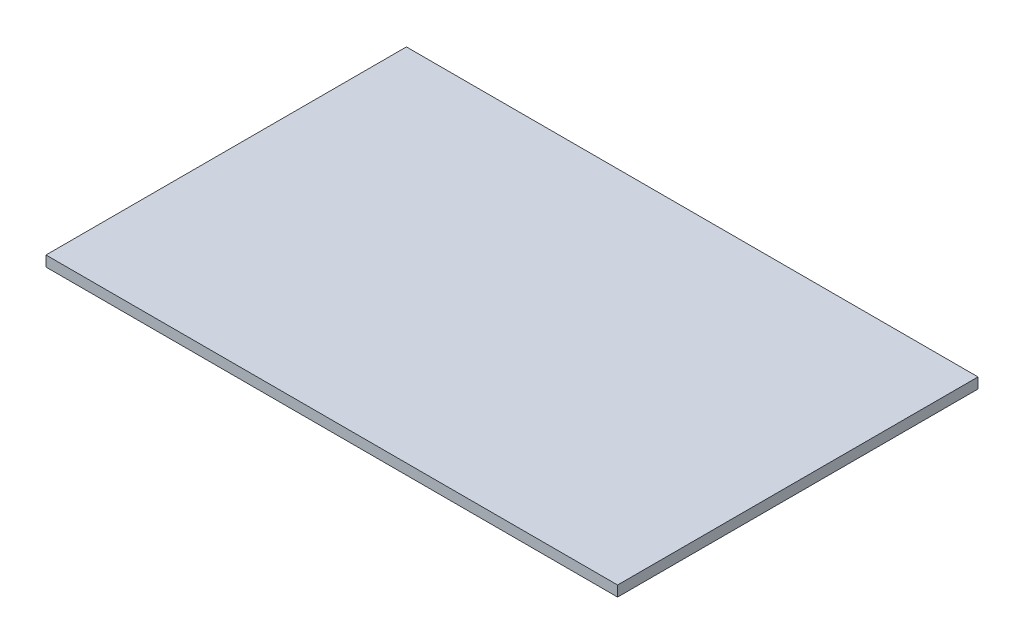
from build123d import *

# Parameters (mm, degrees)
SKETCH1_W           = 54.4
SKETCH1_H           = 34.3
BOSS_EXTRUDE1_DEPTH = 0.5


with BuildPart() as part:
    # Sketch1 → Boss-Extrude1 (new, symmetric)
    with BuildSketch(Plane(origin=(0, 0, 0), x_dir=(1, 0, 0), z_dir=(0, 1, 0))):
        Rectangle(SKETCH1_W, SKETCH1_H)
    extrude(amount=BOSS_EXTRUDE1_DEPTH, both=True)


solid = part.part
